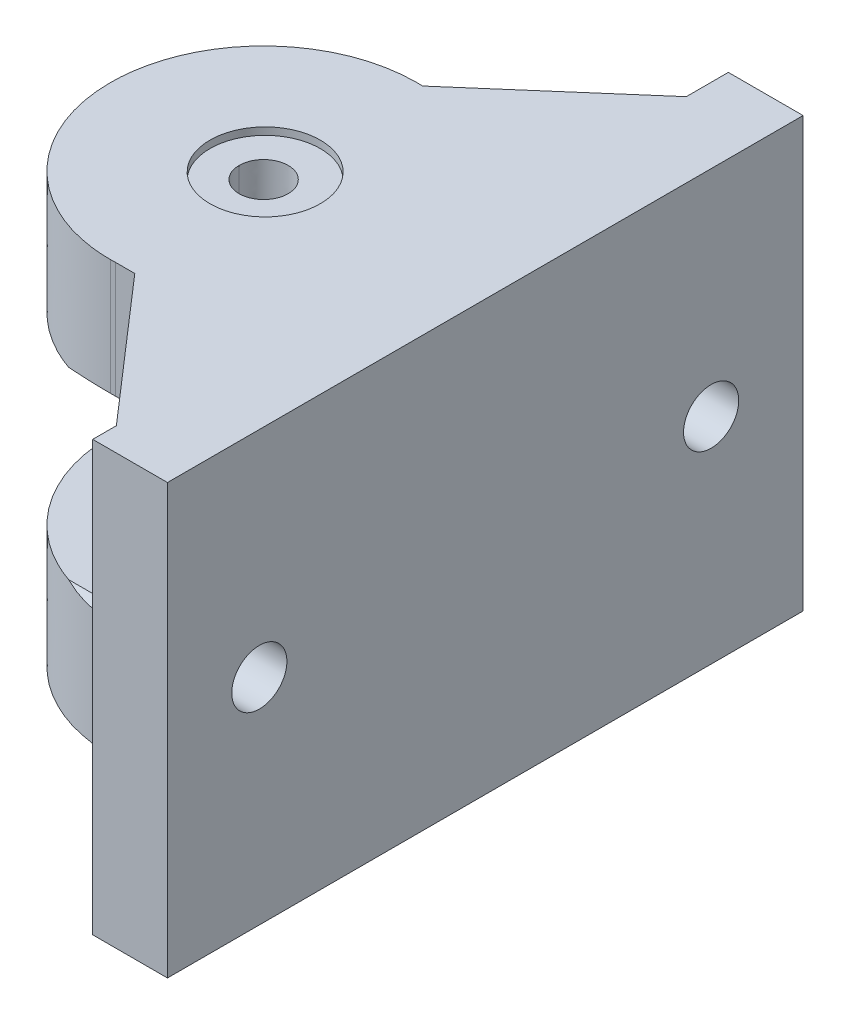
from build123d import *
from OCP.BRepFilletAPI import BRepFilletAPI_MakeChamfer

# Parameters (mm, degrees)
BOSS_EXTRUDE1_DEPTH     = 35
CUT_EXTRUDE1_DEPTH      = 35
CUT_EXTRUDE1_DEPTH_BACK = 35
SKETCH2_W               = 12.895164656
SKETCH2_H               = 15
SKETCH2_W_2             = 11.584994843
CHAMFER1_SIZE           = 10
CHAMFER1_SIZE2          = 11.503684072
SKETCH3_R               = 2.25
CUT_EXTRUDE2_DEPTH      = 68.172434084
CHAMFER2_SIZE           = 1.5
CHAMFER2_SIZE2          = 1.725552611
SKETCH5_R               = 4.5
CUT_EXTRUDE3_DEPTH      = 0.6
CUT_EXTRUDE4_DEPTH      = 1.5
SKETCH9_R               = 10
CUT_EXTRUDE5_DEPTH      = 35


with BuildPart() as part:
    # Sketch1 → Boss-Extrude1 (new body)
    with BuildSketch(Plane(origin=(0, 0, 0), x_dir=(1, 0, 0), z_dir=(0, 1, 0))):
        with BuildLine():
            Line((30.577978508, 38.412125641), (30.577978508, 51.844552938))
            Line((30.577978508, 51.844552938), (24.480159499, 51.844552938))
            Line((24.480159499, 51.844552938), (24.480159499, 38.412125641))
            Line((24.480159499, 38.412125641), (12.895164656, 38.412125641))
            add(Edge.make_bspline(
                [(12.895164656, 38.412125641), (12.763562009, 38.416259756), (12.632476125, 38.422116418), (12.499839949, 38.422116418)],
                knots=[4, 4, 4, 4, 5, 5, 5, 5], degree=3))
            add(Edge.make_bspline(
                [(12.499839949, 38.422116418), (5.596213106, 38.422116418), (0, 32.825903312), (0, 25.922276469)],
                knots=[5, 5, 5, 5, 6, 6, 6, 6], degree=3))
            add(Edge.make_bspline(
                [(0, 25.922276469), (0, 19.018649626), (5.596213106, 13.42243652), (12.499839949, 13.42243652)],
                knots=[6, 6, 6, 6, 7, 7, 7, 7], degree=3))
            add(Edge.make_bspline(
                [(12.499839949, 13.42243652), (12.632476125, 13.42243652), (12.763562009, 13.428293182), (12.895164656, 13.432427297)],
                knots=[7, 7, 7, 7, 8, 8, 8, 8], degree=3))
            Line((12.895164656, 13.432427297), (24.480159499, 13.432427297))
            Line((24.480159499, 13.432427297), (24.480159499, 0))
            Line((24.480159499, 0), (30.577978508, 0))
            Line((30.577978508, 0), (30.577978508, 13.432427297))
            Line((30.577978508, 13.432427297), (30.577978508, 38.412125641))
        make_face()
        with BuildLine():
            add(Edge.make_bspline(
                [(10.49996202, 25.922620979), (10.49996202, 27.027118591), (11.395342337, 27.922498908), (12.500012204, 27.922498908), (13.604509816, 27.922498908), (14.499890133, 27.027118591), (14.499890133, 25.922620979)],
                knots=[2, 2, 2, 2, 3, 3, 3, 4, 4, 4, 4], degree=3))
            add(Edge.make_bspline(
                [(14.499890133, 25.922620979), (14.499890133, 24.817778857), (13.604509816, 23.92239854), (12.500012204, 23.92239854), (11.395342337, 23.92239854), (10.49996202, 24.817778857), (10.49996202, 25.922620979)],
                knots=[0, 0, 0, 0, 1, 1, 1, 2, 2, 2, 2], degree=3))
        make_face(mode=Mode.SUBTRACT)
    extrude(amount=BOSS_EXTRUDE1_DEPTH)

    # Sketch2 → Cut-Extrude1 (cut, two sides: drawn at the far end of the back side and taken through both)
    with BuildSketch(Plane.XY.offset(-13.432427297).offset(-CUT_EXTRUDE1_DEPTH_BACK)):
        with Locations((6.447582328, 17.5)):
            Rectangle(SKETCH2_W, SKETCH2_H)
        with Locations((18.687662078, 17.5)):
            Rectangle(SKETCH2_W_2, SKETCH2_H)
    extrude(amount=CUT_EXTRUDE1_DEPTH + CUT_EXTRUDE1_DEPTH_BACK, mode=Mode.SUBTRACT)

    # Chamfer1: one chamfer whose edges measure the first distance from different faces: ONE call of the kernel's chamfer builder (chamfer() names one face for all edges)
    chamfer1_edges_1 = [part.edges().sort_by_distance(p)[0] for p in [
        (24.480159499, 30, -13.432427297),
    ]]
    chamfer1_side_1 = [part.faces().sort_by_distance(p)[0] for p in [
        (18.687662078, 30, -13.432427297),
    ]]
    chamfer1_edges_2 = [part.edges().sort_by_distance(p)[0] for p in [
        (24.480159499, 30, -38.412125641),
        (24.480159499, 5, -38.412125641),
    ]]
    chamfer1_side_2 = [part.faces().sort_by_distance(p)[0] for p in [
        (24.480159499, 17.5, -25.922276469),
    ]]
    chamfer1_edges_3 = [part.edges().sort_by_distance(p)[0] for p in [
        (24.480159499, 5, -13.432427297),
    ]]
    chamfer1_side_3 = [part.faces().sort_by_distance(p)[0] for p in [
        (18.687662078, 5, -13.432427297),
    ]]
    chamfer1 = BRepFilletAPI_MakeChamfer(part.part.solid().wrapped)
    for e in chamfer1_edges_1:
        chamfer1.Add(CHAMFER1_SIZE, CHAMFER1_SIZE2, e.wrapped, chamfer1_side_1[0].wrapped)  # the first distance lies on this face
    for e in chamfer1_edges_2:
        chamfer1.Add(CHAMFER1_SIZE, CHAMFER1_SIZE2, e.wrapped, chamfer1_side_2[0].wrapped)  # the first distance lies on this face
    for e in chamfer1_edges_3:
        chamfer1.Add(CHAMFER1_SIZE, CHAMFER1_SIZE2, e.wrapped, chamfer1_side_3[0].wrapped)  # the first distance lies on this face
    add(Compound.cast(chamfer1.Shape()), mode=Mode.REPLACE)

    # Sketch3 → Cut-Extrude2 (cut, through all)
    with BuildSketch(Plane.ZY.offset(-24.480159499)):
        with Locations((-44.344552938, 17.5)):
            Circle(SKETCH3_R)
        with Locations((-7.49316056, 17.5)):
            Circle(SKETCH3_R)
    extrude(amount=-CUT_EXTRUDE2_DEPTH, mode=Mode.SUBTRACT)

    # Chamfer2
    chamfer2_edges = [part.edges().sort_by_distance(p)[0] for p in [
        (24.480159499, 17.5, -46.594552938),
        (24.480159499, 17.5, -9.74316056),
    ]]
    chamfer2_side = [part.faces().sort_by_distance(p)[0] for p in [
        (24.480159499, 17.5, -26.741741785),
    ]]
    chamfer(chamfer2_edges, length=CHAMFER2_SIZE, length2=CHAMFER2_SIZE2, reference=chamfer2_side[0])

    # Sketch5 → Cut-Extrude3 (cut)
    with BuildSketch(Plane(origin=(0, 35, 0), x_dir=(1, 0, 0), z_dir=(0, 1, 0))):
        with Locations(Location((12.620921734, 25.922620979, 0), (0, 0, 270))):
            Circle(SKETCH5_R)
    extrude(amount=-CUT_EXTRUDE3_DEPTH, mode=Mode.SUBTRACT)

    # Sketch8 → Cut-Extrude4 (cut)
    with BuildSketch(Plane.XZ):
        Polygon((15.19537285, -28.473323484), (16.084608047, -24.771005389), (13.322924122, -22.149746071), (9.672005001, -23.230804848), (8.782769803, -26.933122943), (11.544453728, -29.554382261), align=None)
    extrude(amount=-CUT_EXTRUDE4_DEPTH, mode=Mode.SUBTRACT)

    # Sketch9 → Cut-Extrude5 (cut)
    with BuildSketch(Plane.ZY.offset(-24.480159499)):
        with Locations((-7.49316056, 17.5)):
            Circle(SKETCH9_R)
        with Locations((-44.344552938, 17.5)):
            Circle(SKETCH9_R)
    extrude(amount=CUT_EXTRUDE5_DEPTH, mode=Mode.SUBTRACT)


solid = part.part
